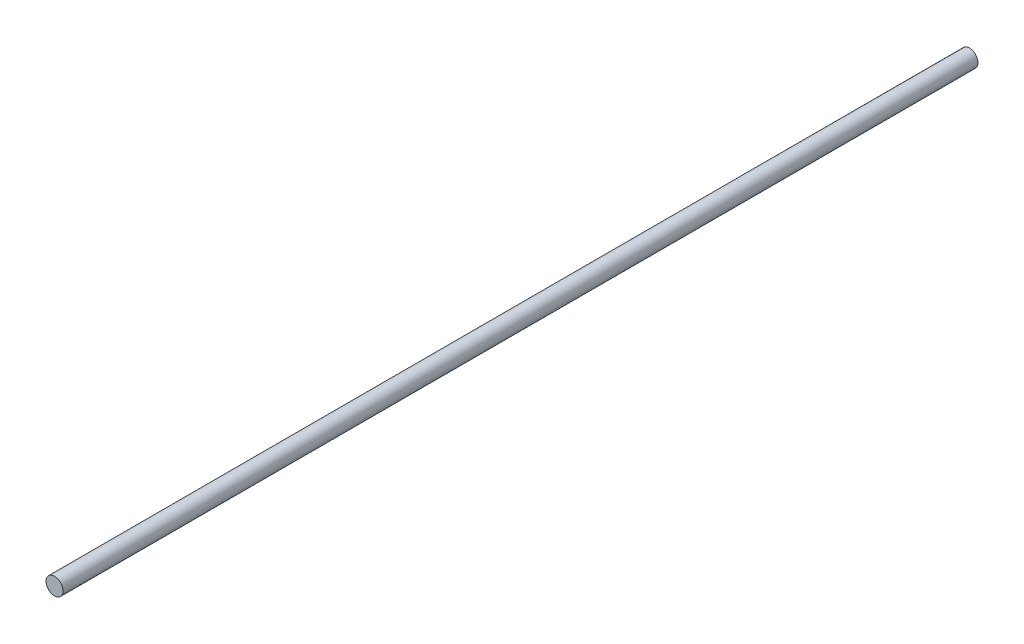
from build123d import *

# Parameters (mm, degrees)
SKETCH_1_R      = 4
EXTRUDE_1_DEPTH = 430


with BuildPart() as part:
    # 草圖1 → 填料-伸長1 (new body)
    with BuildSketch(Plane.XY):
        Circle(SKETCH_1_R)
    extrude(amount=EXTRUDE_1_DEPTH)


solid = part.part
